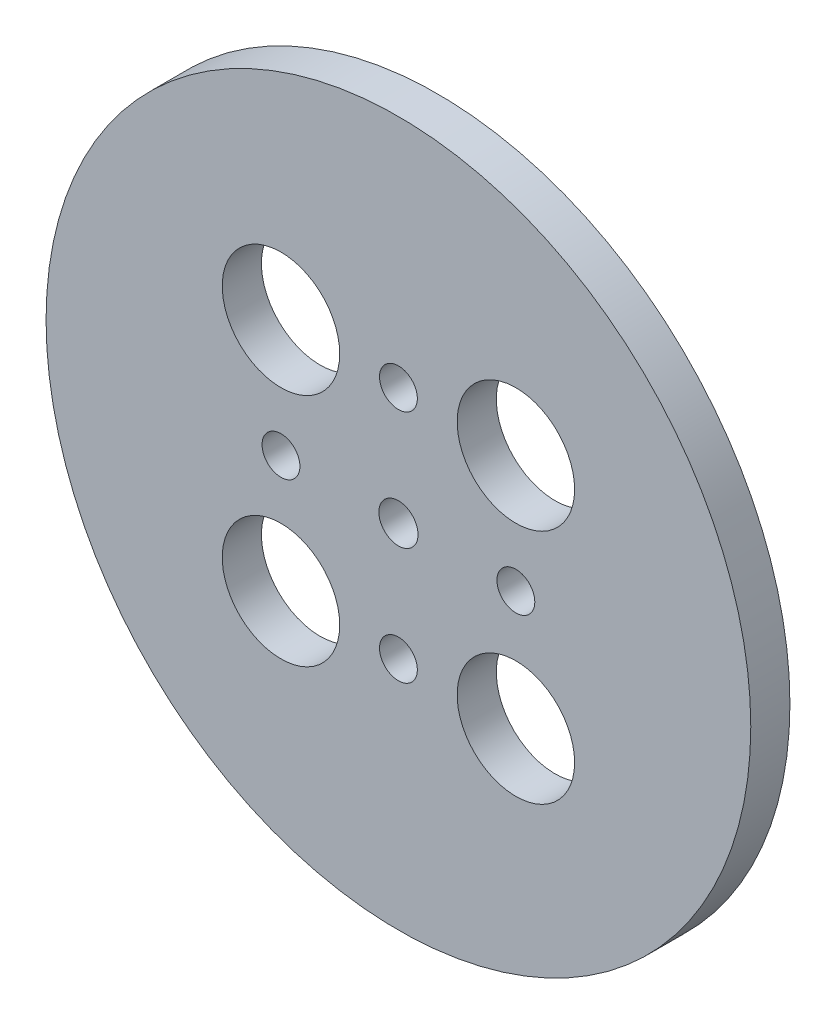
from build123d import *

# Parameters (mm, degrees)
MODEL_R                 = 27
MODEL_R_2               = 4.5
MODEL_R_3               = 1.5
MODEL_R_4               = 1.45
SALIENTE_EXTRUIR1_DEPTH = 3


with BuildPart() as part:
    # Model → Saliente-Extruir1 (new body)
    with BuildSketch(Plane.XY):
        with Locations((215.747807914, 241.952019993)):
            Circle(MODEL_R)
        with Locations((206.747807913, 250.952019993)):
            Circle(MODEL_R_2, mode=Mode.SUBTRACT)
        with Locations((206.747807913, 232.952019993)):
            Circle(MODEL_R_2, mode=Mode.SUBTRACT)
        with Locations((224.747807913, 232.827408196)):
            Circle(MODEL_R_2, mode=Mode.SUBTRACT)
        with Locations((224.747807913, 250.952019993)):
            Circle(MODEL_R_2, mode=Mode.SUBTRACT)
        with Locations((215.747807914, 241.952019993)):
            Circle(MODEL_R_3, mode=Mode.SUBTRACT)
        with Locations((215.747807914, 232.952019993)):
            Circle(MODEL_R_4, mode=Mode.SUBTRACT)
        with Locations((215.747807914, 250.952019993)):
            Circle(MODEL_R_4, mode=Mode.SUBTRACT)
        with Locations((224.747807913, 241.952019993)):
            Circle(MODEL_R_4, mode=Mode.SUBTRACT)
        with Locations((206.747807913, 241.952019993)):
            Circle(MODEL_R_4, mode=Mode.SUBTRACT)
    extrude(amount=SALIENTE_EXTRUIR1_DEPTH)


solid = part.part
